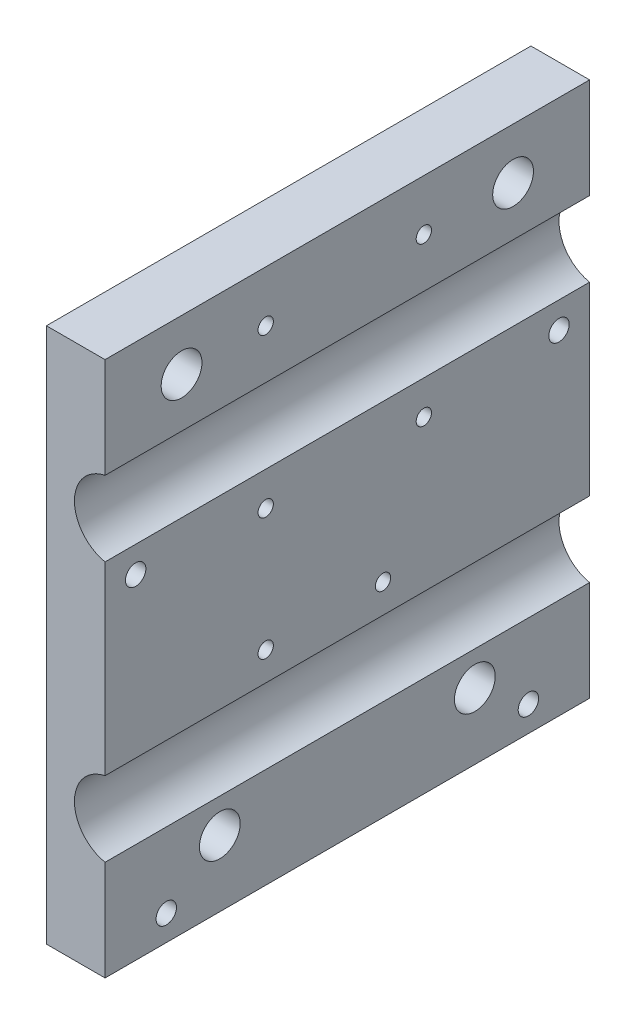
from build123d import *

# Parameters (mm, degrees)
BOSS_EXTRUDE1_DEPTH               = 95
SKETCH2_R                         = 2
CUT_EXTRUDE1_DEPTH                = 143.06424603
ESQUISSE2_R                       = 2
ENL_V_MAT_EXTRU_2_DEPTH           = 143.06424603
ESQUISSE3_R                       = 4
ENL_V_MAT_EXTRU_3CNC_DEPTH        = 143.06424603
ESQUISSE4_R                       = 1.5
ENL_V_MAT_EXTRU_4_3DPRINTER_DEPTH = 143.06424603


with BuildPart() as part:
    # Sketch1 → Boss-Extrude1 (new body)
    with BuildSketch(Plane.XY):
        with BuildLine():
            Line((0, -19.651530772), (0, 0))
            Line((0, 0), (-11.5, 0))
            Line((-11.5, 0), (-11.5, -52.5))
            Line((-11.5, -52.5), (0, -52.5))
            Line((0, -52.5), (0, -34.348469228))
            ThreePointArc((0, -34.348469228), (-6, -27), (0, -19.651530772))
        make_face()
        with BuildLine():
            Line((0, -52.5), (-11.5, -52.5))
            Line((-11.5, -52.5), (-11.5, -105))
            Line((-11.5, -105), (0, -105))
            Line((0, -105), (0, -85.348469228))
            ThreePointArc((0, -85.348469228), (-6, -78), (0, -70.651530772))
            Line((0, -70.651530772), (0, -52.5))
        make_face()
    extrude(amount=BOSS_EXTRUDE1_DEPTH)

    # Sketch2 → Cut-Extrude1 (cut, through all)
    with BuildSketch(Plane(origin=(0, 0, 0), x_dir=(0, 0, -1), z_dir=(1, 0, 0))):
        with Locations(Location((-83, -100, 0), (0, 0, 90))):
            Circle(SKETCH2_R)
        with Locations(Location((-12, -100, 0), (0, 0, 270))):
            Circle(SKETCH2_R)
    extrude(amount=-CUT_EXTRUDE1_DEPTH, mode=Mode.SUBTRACT)

    # Esquisse2 → Enlèv. mat.-Extru.2 (cut, through all)
    with BuildSketch(Plane(origin=(0, 0, 0), x_dir=(0, 0, -1), z_dir=(1, 0, 0))):
        with Locations(Location((-6, -39.5, 0), (0, 0, 90))):
            Circle(ESQUISSE2_R)
        with Locations(Location((-89, -39.5, 0), (0, 0, 90))):
            Circle(ESQUISSE2_R)
    extrude(amount=-ENL_V_MAT_EXTRU_2_DEPTH, mode=Mode.SUBTRACT)

    # Esquisse3 → Enlèv. mat.-Extru.3CNC (cut, through all)
    with BuildSketch(Plane.ZY.offset(11.5)):
        with Locations((80, -10)):
            Circle(ESQUISSE3_R)
        with Locations((15, -10)):
            Circle(ESQUISSE3_R)
        with Locations((72.5, -92)):
            Circle(ESQUISSE3_R)
        with Locations((22.5, -92)):
            Circle(ESQUISSE3_R)
    extrude(amount=-ENL_V_MAT_EXTRU_3CNC_DEPTH, mode=Mode.SUBTRACT)

    # Esquisse4 → Enlèv. mat.-Extru.4-3Dprinter (cut, through all)
    with BuildSketch(Plane(origin=(0, 0, 0), x_dir=(0, 0, -1), z_dir=(1, 0, 0))):
        with Locations(Location((-32.5, -10, 0), (0, 0, 90))):
            Circle(ESQUISSE4_R)
        with Locations(Location((-63.5, -10, 0), (0, 0, 90))):
            Circle(ESQUISSE4_R)
        with Locations(Location((-63.5, -41, 0), (0, 0, 90))):
            Circle(ESQUISSE4_R)
        with Locations(Location((-32.5, -41, 0), (0, 0, 90))):
            Circle(ESQUISSE4_R)
        with Locations(Location((-40.5, -65, 0), (0, 0, 90))):
            Circle(ESQUISSE4_R)
        with Locations(Location((-63.5, -65, 0), (0, 0, 90))):
            Circle(ESQUISSE4_R)
    extrude(amount=-ENL_V_MAT_EXTRU_4_3DPRINTER_DEPTH, mode=Mode.SUBTRACT)


solid = part.part
